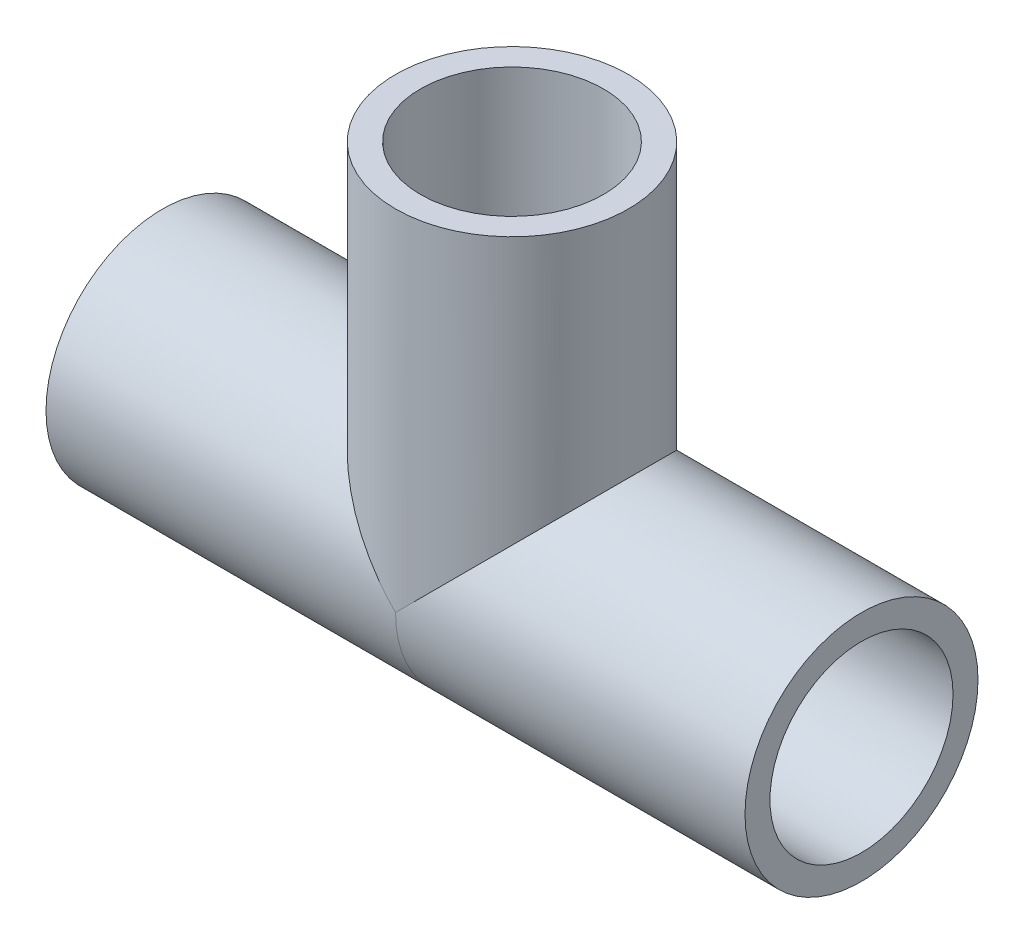
from build123d import *
from build123d.topology import SkipClean

# Parameters (mm, degrees)
SKETCH3_R           = 14
SKETCH3_R_2         = 11
SKETCH5_R           = 14
SKETCH5_R_2         = 11
BOSS_EXTRUDE1_DEPTH = 42
CUT_EXTRUDE1_START  = -95
SKETCH6_R           = 11
CUT_EXTRUDE1_DEPTH  = 95
CUT_EXTRUDE2_START  = -33
SKETCH7_R           = 11
CUT_EXTRUDE2_DEPTH  = 33


with BuildPart() as part:
    # Sweep1: sweep along a path in Sketch1
    with BuildLine(Plane.XY) as sweep1_path:
        Line((42, 0), (0, 0))
        Line((0, 0), (-42, 0))
    # Sketch3 → Sweep1 (sweep)
    with BuildSketch(Plane(origin=(32, 0, 0), x_dir=(0, 0, -1), z_dir=(1, 0, 0))):
        Circle(SKETCH3_R)
        Circle(SKETCH3_R_2, mode=Mode.SUBTRACT)
    sweep(path=sweep1_path.line)

    # Sketch5 → Boss-Extrude1 (add)
    with BuildSketch(Plane(origin=(0, 0, 0), x_dir=(1, 0, 0), z_dir=(0, 1, 0))):
        with Locations(Location((0, 0, 0), (0, 0, 270))):
            Circle(SKETCH5_R)
        with Locations(Location((0, 0, 0), (0, 0, 270))):
            Circle(SKETCH5_R_2, mode=Mode.SUBTRACT)
    extrude(amount=BOSS_EXTRUDE1_DEPTH)

    # Sketch6 → Cut-Extrude1 (cut)
    with SkipClean():  # the faces are left unmerged after this step: merging them gives an invalid solid
        with BuildSketch(Plane(origin=(42, 0, 0), x_dir=(0, 0, -1), z_dir=(1, 0, 0)).offset(CUT_EXTRUDE1_START)):
            Circle(SKETCH6_R)
        extrude(amount=CUT_EXTRUDE1_DEPTH, mode=Mode.SUBTRACT)

    # Sketch7 → Cut-Extrude2 (cut)
    with SkipClean():  # the faces are left unmerged after this step: merging them gives an invalid solid
        with BuildSketch(Plane(origin=(0, 42, 0), x_dir=(1, 0, 0), z_dir=(0, 1, 0)).offset(CUT_EXTRUDE2_START)):
            with Locations(Location((0, 0, 0), (0, 0, 270))):
                Circle(SKETCH7_R)
        extrude(amount=CUT_EXTRUDE2_DEPTH, mode=Mode.SUBTRACT)


solid = part.part
